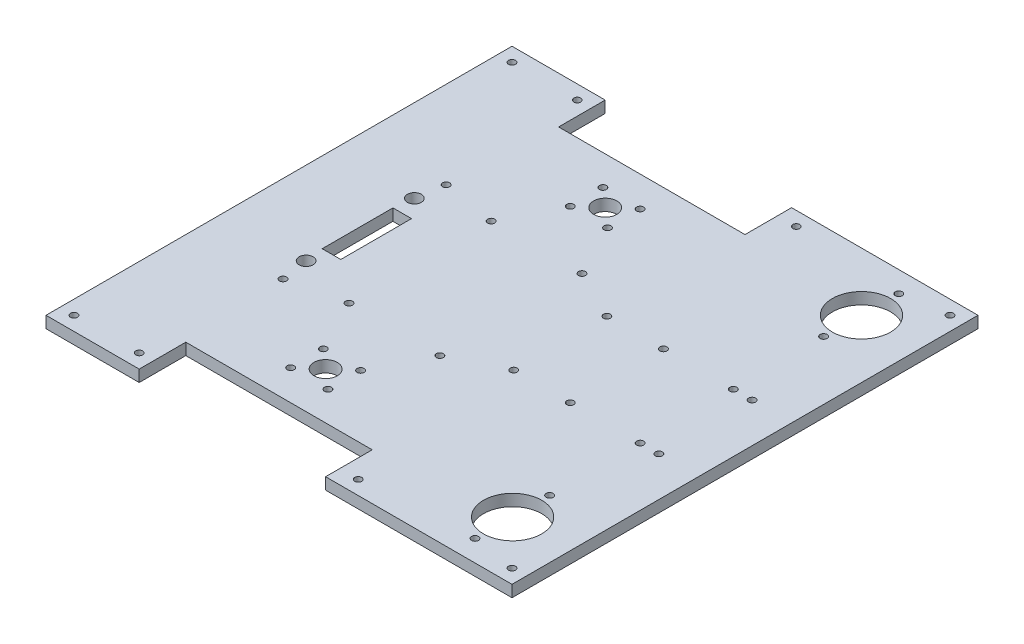
from build123d import *

# Parameters (mm, degrees)
BOSS_EXTRUDE1_DEPTH      = 5
SKETCH14_R               = 5
CUT_EXTRUDE1_DEPTH       = 10
SKETCH15_R               = 1.5
CUT_EXTRUDE2_DEPTH       = 10
SKETCH16_R               = 1.5
CUT_EXTRUDE3_DEPTH       = 20
SKETCH18_R               = 1.5
SKETCH18_R_2             = 3
SKETCH18_W               = 7.984692674
SKETCH18_H               = 30.35846694
CUT_EXTRUDE4_DEPTH       = 20
SKETCH20_R               = 12.5
CUT_EXTRUDE5_DEPTH       = 20
SKETCH21_R               = 1.5
CUT_EXTRUDE6_DEPTH       = 20
SKETCH22_R               = 1.5
CUT_EXTRUDE8_DEPTH       = 5
SKETCH23_R               = 1.5
CUT_EXTRUDE9_DEPTH       = 10
CUT_EXTRUDE10_DEPTH      = 25
CUT_EXTRUDE10_DEPTH_BACK = 15
SKETCH24_R               = 1.5


with BuildPart() as part:
    # Sketch1 → Boss-Extrude1 (new body)
    with BuildSketch(Plane(origin=(0, 0, 0), x_dir=(1, 0, 0), z_dir=(0, 1, 0))):
        Polygon((27.547169811, 149.902137597), (27.547169811, 129.902137597), (107.547169811, 129.902137597), (107.547169811, 149.902137597), (187.547169811, 149.902137597), (187.547169811, -50.097862403), (107.547169811, -50.097862403), (107.547169811, -30.097862403), (27.547169811, -30.097862403), (27.547169811, -50.097862403), (-12.452830189, -50.097862403), (-12.452830189, 149.902137597), align=None)
    extrude(amount=BOSS_EXTRUDE1_DEPTH)

    # Sketch14 → Cut-Extrude1 (cut)
    with BuildSketch(Plane(origin=(0, 5, 0), x_dir=(1, 0, 0), z_dir=(0, 1, 0))):
        with Locations((67.547169811, 109.902137597)):
            Circle(SKETCH14_R)
        with Locations((67.547169811, -10.097862403)):
            Circle(SKETCH14_R)
    extrude(amount=-CUT_EXTRUDE1_DEPTH, mode=Mode.SUBTRACT)

    # Sketch15 → Cut-Extrude2 (cut)
    with BuildSketch(Plane(origin=(0, 5, 0), x_dir=(1, 0, 0), z_dir=(0, 1, 0))):
        with Locations((75.547169811, 116.902137597)):
            Circle(SKETCH15_R)
        with Locations((59.547169811, 116.902137597)):
            Circle(SKETCH15_R)
        with Locations((59.547169811, 102.902137597)):
            Circle(SKETCH15_R)
        with Locations((75.547169811, 102.902137597)):
            Circle(SKETCH15_R)
        with Locations((59.547169811, -3.097862403)):
            Circle(SKETCH15_R)
        with Locations((75.547169811, -3.097862403)):
            Circle(SKETCH15_R)
        with Locations((59.547169811, -17.097862403)):
            Circle(SKETCH15_R)
        with Locations((75.547169811, -17.097862403)):
            Circle(SKETCH15_R)
    extrude(amount=-CUT_EXTRUDE2_DEPTH, mode=Mode.SUBTRACT)

    # Sketch16 → Cut-Extrude3 (cut)
    with BuildSketch(Plane(origin=(0, 5, 0), x_dir=(1, 0, 0), z_dir=(0, 1, 0))):
        with Locations((87.062266283, 80.426964221)):
            Circle(SKETCH16_R)
        with Locations((48.062266283, 80.426964221)):
            Circle(SKETCH16_R)
        with Locations((87.062266283, 19.426964221)):
            Circle(SKETCH16_R)
        with Locations((48.062266283, 19.426964221)):
            Circle(SKETCH16_R)
    extrude(amount=-CUT_EXTRUDE3_DEPTH, mode=Mode.SUBTRACT)

    # Sketch18 → Cut-Extrude4 (cut)
    with BuildSketch(Plane.XZ):
        with Locations((24.913238559, -14.26042599)):
            Circle(SKETCH18_R)
        with Locations((24.913238559, -84.26042599)):
            Circle(SKETCH18_R)
        with Locations((23.117005466, -25.963721395)):
            Circle(SKETCH18_R_2)
        with Locations((23.117005466, -72.426892222)):
            Circle(SKETCH18_R_2)
        with Locations((26.070184113, -49.086318125)):
            Rectangle(SKETCH18_W, SKETCH18_H)
    extrude(amount=-CUT_EXTRUDE4_DEPTH, mode=Mode.SUBTRACT)

    # Sketch20 → Cut-Extrude5 (cut)
    with BuildSketch(Plane(origin=(0, 0, 0), x_dir=(-1, 0, 0), z_dir=(0, -1, 0))):
        with Locations((-162.680311237, -24.96964283)):
            Circle(SKETCH20_R)
        with Locations((-162.547169811, 124.902137597)):
            Circle(SKETCH20_R)
    extrude(amount=-CUT_EXTRUDE5_DEPTH, mode=Mode.SUBTRACT)

    # Sketch21 → Cut-Extrude6 (cut)
    with BuildSketch(Plane(origin=(0, 5, 0), x_dir=(1, 0, 0), z_dir=(0, 1, 0))):
        with Locations((162.547169811, 140.913002397)):
            Circle(SKETCH21_R)
        with Locations((162.290839353, 108.90419102)):
            Circle(SKETCH21_R)
        with Locations((162.547169811, -8.970196797)):
            Circle(SKETCH21_R)
        with Locations((162.547169811, -40.969088863)):
            Circle(SKETCH21_R)
    extrude(amount=-CUT_EXTRUDE6_DEPTH, mode=Mode.SUBTRACT)

    # Sketch22 → Cut-Extrude8 (cut)
    with BuildSketch(Plane(origin=(0, 5, 0), x_dir=(1, 0, 0), z_dir=(0, 1, 0))):
        with Locations((115.547169811, 143.902137597)):
            Circle(SKETCH22_R)
        with Locations((181.547169811, -44.097862403)):
            Circle(SKETCH22_R)
        with Locations((181.547169811, 143.902137597)):
            Circle(SKETCH22_R)
        with Locations((115.547169811, -44.097862403)):
            Circle(SKETCH22_R)
        with Locations((-6.452830189, 143.902137597)):
            Circle(SKETCH22_R)
        with Locations((21.547169811, 143.902137597)):
            Circle(SKETCH22_R)
        with Locations((-6.452830189, -44.097862403)):
            Circle(SKETCH22_R)
        with Locations((21.547169811, -44.097862403)):
            Circle(SKETCH22_R)
    extrude(amount=-CUT_EXTRUDE8_DEPTH, mode=Mode.SUBTRACT)

    # Sketch23 → Cut-Extrude9 (cut)
    with BuildSketch(Plane(origin=(0, 5, 0), x_dir=(1, 0, 0), z_dir=(0, 1, 0))):
        with Locations((162.547169811, 69.902137597)):
            Circle(SKETCH23_R)
        with Locations((162.547169811, 29.902137597)):
            Circle(SKETCH23_R)
        with Locations((132.547169811, 69.902137597)):
            Circle(SKETCH23_R)
        with Locations((132.547169811, 29.902137597)):
            Circle(SKETCH23_R)
        with Locations((108.269324535, 69.902137597)):
            Circle(SKETCH23_R)
        with Locations((108.269324535, 29.902137597)):
            Circle(SKETCH23_R)
    extrude(amount=-CUT_EXTRUDE9_DEPTH, mode=Mode.SUBTRACT)

    # Sketch24 → Cut-Extrude10 (cut, two sides: drawn at the far end of the back side and taken through both)
    with BuildSketch(Plane(origin=(0, 5, 0), x_dir=(1, 0, 0), z_dir=(0, 1, 0)).offset(-CUT_EXTRUDE10_DEPTH_BACK)):
        with Locations((170.581543225, 69.902137597)):
            Circle(SKETCH24_R)
        with Locations((170.581543225, 29.902137597)):
            Circle(SKETCH24_R)
    extrude(amount=CUT_EXTRUDE10_DEPTH + CUT_EXTRUDE10_DEPTH_BACK, mode=Mode.SUBTRACT)


solid = part.part
